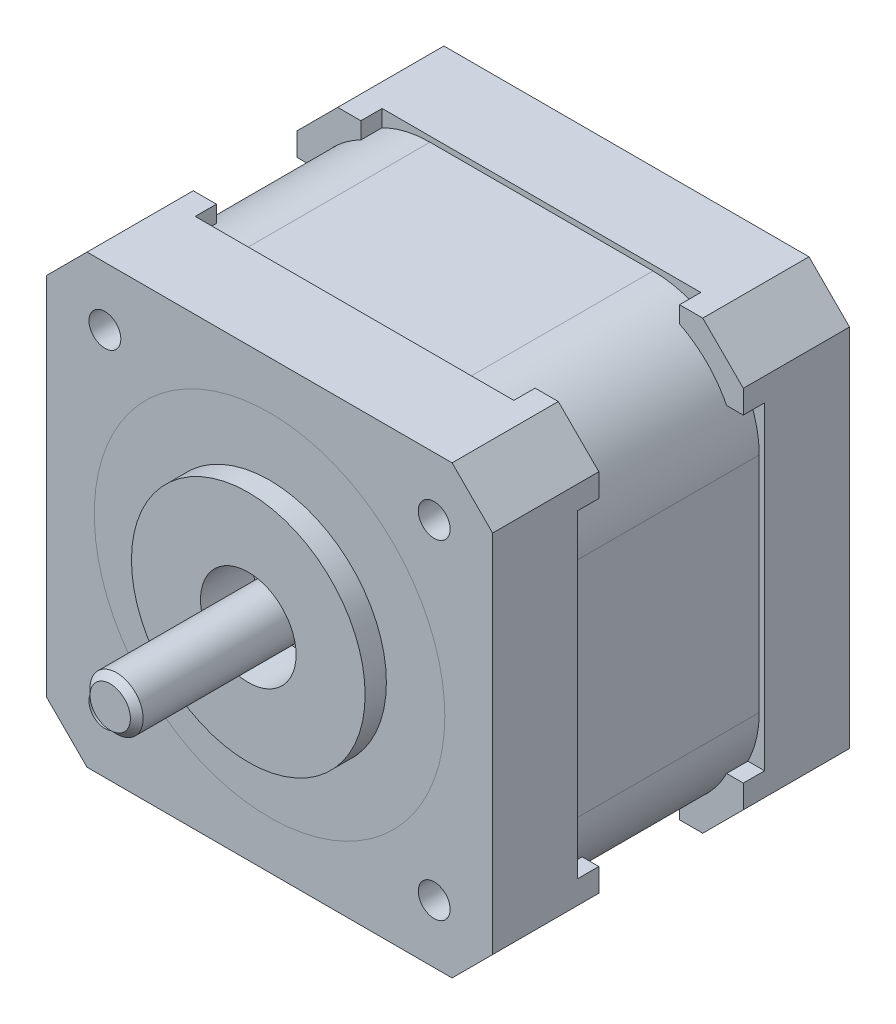
from build123d import *

# Parameters (mm, degrees)
SALIENTE_EXTRUIR1_DEPTH = 16.8
CORTAR_EXTRUIR1_START   = -8
CROQUIS2_W              = 30
CROQUIS2_H              = 6
CROQUIS2_H_2            = 30
CROQUIS2_W_2            = 6
CORTAR_EXTRUIR1_DEPTH   = 17.6
CORTAR_EXTRUIR2_START   = -10
CORTAR_EXTRUIR2_DEPTH   = 13.6
CORTAR_EXTRUIR3_START   = -25.6
CORTAR_EXTRUIR3_DEPTH   = 17.6
SALIENTE_EXTRUIR2_START = -25.6
SALIENTE_EXTRUIR2_DEPTH = 17.6
CROQUIS5_R              = 16.5
CROQUIS5_R_2            = 11
CROQUIS5_R_3            = 4.5
CROQUIS5_R_4            = 2.5
CORTAR_EXTRUIR4_DEPTH   = 3
CROQUIS5_3_R            = 16.5
CROQUIS5_3_R_2          = 11
SALIENTE_EXTRUIR3_DEPTH = 3
SALIENTE_EXTRUIR4_START = -3
CROQUIS5_4_R            = 11
CROQUIS5_4_R_2          = 4.5
SALIENTE_EXTRUIR4_DEPTH = 5
SALIENTE_EXTRUIR5_START = -3
CROQUIS5_5_R            = 2.5
SALIENTE_EXTRUIR5_DEPTH = 18
CHAFL_N1_SIZE           = 0.6
CROQUIS6_R              = 1.5
CORTAR_EXTRUIR5_DEPTH   = 6


with BuildPart() as part:
    # Croquis1 → Saliente-Extruir1 (new, symmetric)
    with BuildSketch(Plane.XY):
        Polygon((-17.183766184, 21), (-21, 17.183766184), (-21, -17.183766184), (-17.183766184, -21), (17.183766184, -21), (21, -17.183766184), (21, 17.183766184), (17.183766184, 21), align=None)
    extrude(amount=SALIENTE_EXTRUIR1_DEPTH, both=True)

    # Croquis2 → Cortar-Extruir1 (cut)
    with BuildSketch(Plane.XY.offset(16.8).offset(CORTAR_EXTRUIR1_START)):
        with Locations((0, 18)):
            Rectangle(CROQUIS2_W, CROQUIS2_H)
        Rectangle(CROQUIS2_W, CROQUIS2_H_2)
        with Locations((18, 0)):
            Rectangle(CROQUIS2_W_2, CROQUIS2_H_2)
        with Locations((0, -18)):
            Rectangle(CROQUIS2_W, CROQUIS2_H)
        with Locations((-18, 0)):
            Rectangle(CROQUIS2_W_2, CROQUIS2_H_2)
    extrude(amount=-CORTAR_EXTRUIR1_DEPTH, mode=Mode.SUBTRACT)

    # Croquis3 → Cortar-Extruir2 (cut)
    with BuildSketch(Plane(origin=(0, 0, -16.8), x_dir=(-1, 0, 0), z_dir=(0, 0, -1)).offset(CORTAR_EXTRUIR2_START)):
        Polygon((-17.183766184, 21), (-21, 17.183766184), (-21, -17.183766184), (-17.183766184, -21), (17.183766184, -21), (21, -17.183766184), (21, 17.183766184), (17.183766184, 21), align=None)
    extrude(amount=-CORTAR_EXTRUIR2_DEPTH, mode=Mode.SUBTRACT)


with BuildPart() as cortar_extruir2_piece_1:
    # of the separate pieces the step leaves, piece 1, a body of its own (cortar_extruir2_pieces)
    add(part.part.solids().sort_by_distance((-17.183766184, 21, 16.8))[0])


with BuildPart() as cortar_extruir2_piece_2:
    # of the separate pieces the step leaves, piece 2, a body of its own (cortar_extruir2_pieces)
    add(part.part.solids().sort_by_distance((-17.183766184, 21, -6.8))[0])


with BuildPart() as cortar_extruir3_tool:
    # Croquis4<4> → Cortar-Extruir3 (new body)
    with BuildSketch(Plane.XY.offset(16.8).offset(CORTAR_EXTRUIR3_START)):
        with BuildLine():
            Line((-20.5, 10.5), (-20.5, -10.5))
            ThreePointArc((-20.5, -10.5), (-17.571067812, -17.571067812), (-10.5, -20.5))
            Line((-10.5, -20.5), (10.5, -20.5))
            ThreePointArc((10.5, -20.5), (17.571067812, -17.571067812), (20.5, -10.5))
            Line((20.5, -10.5), (20.5, 10.5))
            ThreePointArc((20.5, 10.5), (17.571067812, 17.571067812), (10.5, 20.5))
            Line((10.5, 20.5), (-10.5, 20.5))
            ThreePointArc((-10.5, 20.5), (-17.571067812, 17.571067812), (-20.5, 10.5))
        make_face()
    extrude(amount=CORTAR_EXTRUIR3_DEPTH)


with BuildPart() as cortar_extruir2_piece_1_1:
    add(cortar_extruir2_piece_1.part)

    # Cortar-Extruir3: cut by cortar_extruir3_tool
    add(cortar_extruir3_tool.part, mode=Mode.SUBTRACT)

    # Croquis5 → Cortar-Extruir4 (cut)
    # profile 1 of 4: a face of its own
    with BuildSketch(Plane.XY.offset(16.8)):
        Circle(CROQUIS5_R)
        Circle(CROQUIS5_R_2, mode=Mode.SUBTRACT)
    # profile 2 of 4: a face of its own
    with BuildSketch(Plane.XY.offset(16.8)):
        Circle(CROQUIS5_R_2)
        Circle(CROQUIS5_R_3, mode=Mode.SUBTRACT)
    # profile 3 of 4: a face of its own
    with BuildSketch(Plane.XY.offset(16.8)):
        Circle(CROQUIS5_R_3)
        Circle(CROQUIS5_R_4, mode=Mode.SUBTRACT)
    # profile 4 of 4: a face of its own
    with BuildSketch(Plane.XY.offset(16.8)):
        Circle(CROQUIS5_R_4)
    extrude(amount=-CORTAR_EXTRUIR4_DEPTH, mode=Mode.SUBTRACT)

    # Croquis5<5> → Saliente-Extruir5 (add)
    with BuildSketch(Plane.XY.offset(16.8).offset(SALIENTE_EXTRUIR5_START)):
        Circle(CROQUIS5_5_R)
    extrude(amount=SALIENTE_EXTRUIR5_DEPTH)

    # Chaflán1
    chafl_n1_edges = [cortar_extruir2_piece_1_1.edges().sort_by_distance(p)[0] for p in [
        (-2.5, 0, 31.8),
    ]]
    chamfer(chafl_n1_edges, length=CHAFL_N1_SIZE)

    # Croquis6 → Cortar-Extruir5 (cut)
    with BuildSketch(Plane.XY.offset(16.8)):
        with Locations((-15.5, -15.5)):
            Circle(CROQUIS6_R)
        with Locations((15.5, -15.5)):
            Circle(CROQUIS6_R)
        with Locations((15.5, 15.5)):
            Circle(CROQUIS6_R)
        with Locations((-15.5, 15.5)):
            Circle(CROQUIS6_R)
    extrude(amount=-CORTAR_EXTRUIR5_DEPTH, mode=Mode.SUBTRACT)


with BuildPart() as cortar_extruir2_piece_2_1:
    add(cortar_extruir2_piece_2.part)

    # Cortar-Extruir3: cut by cortar_extruir3_tool
    add(cortar_extruir3_tool.part, mode=Mode.SUBTRACT)


with BuildPart() as body_3:
    # Croquis4 → Saliente-Extruir2 (new body)
    with BuildSketch(Plane.XY.offset(16.8).offset(SALIENTE_EXTRUIR2_START)):
        with BuildLine():
            Line((-20.5, 10.5), (-20.5, -10.5))
            ThreePointArc((-20.5, -10.5), (-17.571067812, -17.571067812), (-10.5, -20.5))
            Line((-10.5, -20.5), (10.5, -20.5))
            ThreePointArc((10.5, -20.5), (17.571067812, -17.571067812), (20.5, -10.5))
            Line((20.5, -10.5), (20.5, 10.5))
            ThreePointArc((20.5, 10.5), (17.571067812, 17.571067812), (10.5, 20.5))
            Line((10.5, 20.5), (-10.5, 20.5))
            ThreePointArc((-10.5, 20.5), (-17.571067812, 17.571067812), (-20.5, 10.5))
        make_face()
    extrude(amount=SALIENTE_EXTRUIR2_DEPTH)


with BuildPart() as body_4:
    # Croquis5<3> → Saliente-Extruir3 (new body)
    with BuildSketch(Plane.XY.offset(16.8)):
        Circle(CROQUIS5_3_R)
        Circle(CROQUIS5_3_R_2, mode=Mode.SUBTRACT)
    extrude(amount=-SALIENTE_EXTRUIR3_DEPTH)

    # Croquis5<4> → Saliente-Extruir4 (add)
    with BuildSketch(Plane.XY.offset(16.8).offset(SALIENTE_EXTRUIR4_START)):
        Circle(CROQUIS5_4_R)
        Circle(CROQUIS5_4_R_2, mode=Mode.SUBTRACT)
    extrude(amount=SALIENTE_EXTRUIR4_DEPTH)


solid = Compound([cortar_extruir2_piece_1_1.part, cortar_extruir2_piece_2_1.part, body_3.part, body_4.part])
